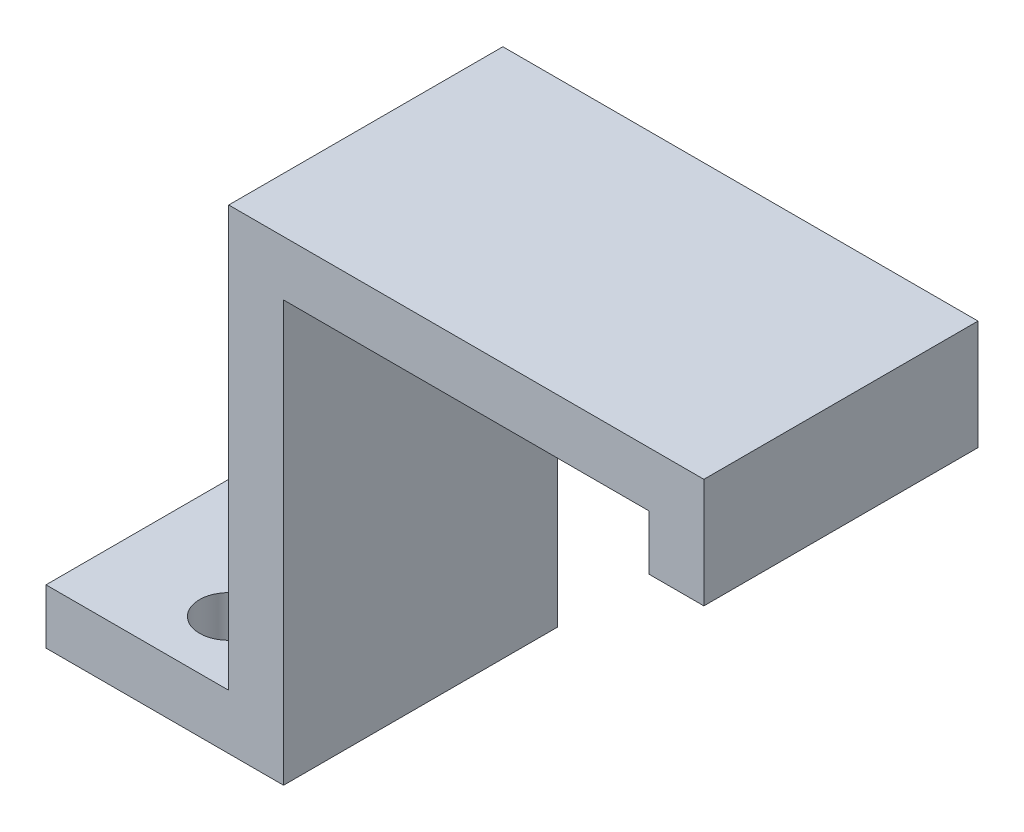
from build123d import *

# Parameters (mm, degrees)
EXTRUDE_1_DEPTH     = 15
SKETCH_2_R          = 1.6
CUT_EXTRUDE_1_DEPTH = 3


with BuildPart() as part:
    # 草圖1 → 填料-伸長1 (new body)
    with BuildSketch(Plane.XY):
        Polygon((0, 0), (26, 0), (26, -6), (23, -6), (23, -3), (3, -3), (3, -26), (-10, -26), (-10, -23), (0, -23), align=None)
    extrude(amount=EXTRUDE_1_DEPTH)

    # 草圖2 → 除料-伸長1 (cut)
    with BuildSketch(Plane(origin=(0, -23, 0), x_dir=(1, 0, 0), z_dir=(0, 1, 0))):
        with Locations(Location((-6.5, -3.5, 0), (0, 0, 270))):
            Circle(SKETCH_2_R)
        with Locations(Location((-3.5, -11.5, 0), (0, 0, 270))):
            Circle(SKETCH_2_R)
    extrude(amount=-CUT_EXTRUDE_1_DEPTH, mode=Mode.SUBTRACT)


solid = part.part
